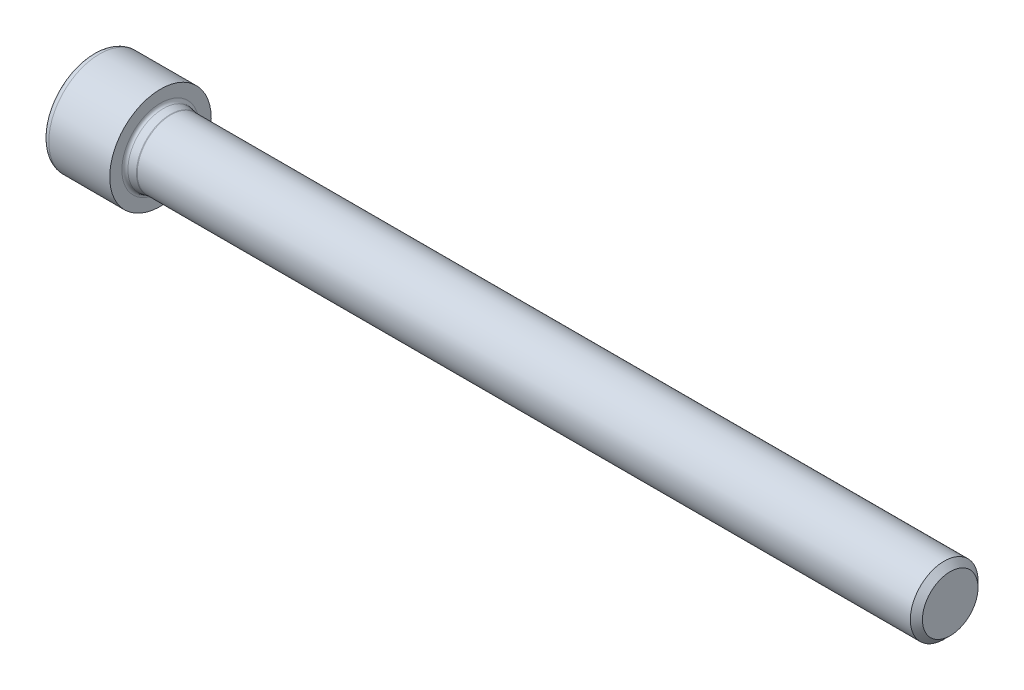
from build123d import *
from build123d.topology import SkipClean

# Parameters (mm, degrees)
SKETCH1_W           = 12
SKETCH1_H           = 9
CUT_EXTRUDE1_START  = 1.272656
CUT_EXTRUDE1_DEPTH  = 0.424218618
CUT_EXTRUDE2_DEPTH  = 5.575781382
SKETCH4_R           = 6.3565957
BOSS_EXTRUDE1_DEPTH = 1.811506156
BOSS_EXTRUDE1_TAPER = 11.136309431
SKETCH5_R           = 6
BOSS_EXTRUDE2_DEPTH = 138.188493844
CHAMFER1_SIZE       = 1.0735
FILLET1_R           = 0.6
FILLET2_R           = 1.2


with BuildPart() as part:
    # Sketch1 → Revolve1 (revolve)
    with BuildSketch(Plane.XY, mode=Mode.PRIVATE) as revolve1_sk:
        with Locations((-6, 4.5)):
            Rectangle(SKETCH1_W, SKETCH1_H)
    revolve(revolve1_sk.sketch.rotate(Axis((-12, 0, 0), (1, 0, 0)), 270), axis=Axis((-12, 0, 0), (1, 0, 0)))

    # Sketch2 → Cut-Extrude1 (cut)
    with BuildSketch(Plane.ZY.offset(10.727344145).offset(CUT_EXTRUDE1_START)):
        Polygon((-2.541695199, 4.306054284), (-2.494007969, 4.33358652), (-2.458304232, 4.354200082), (0, 5.773502692), (2.458305244, 4.354200082), (2.505992237, 4.326667984), (2.541695697, 4.306054284), (5, 2.886751346), (5, 0.048145191), (5, -0.00115583), (5, -0.048145419), (5, -2.886751346), (2.541695697, -4.306053956), (2.494008981, -4.333586191), (2.458305244, -4.354199753), (0, -5.773502692), (-2.458304232, -4.354199753), (-2.505991462, -4.326667518), (-2.541695199, -4.306053956), (-5, -2.886751346), (-5, -0.048145419), (-5, -0.00115583), (-5, 0.048145191), (-5, 2.886751346), align=None)
    extrude(amount=-CUT_EXTRUDE1_DEPTH, mode=Mode.SUBTRACT)

    # Sketch3 → Cut-Extrude2 (cut)
    with SkipClean():  # the faces are left unmerged after this step: merging them gives an invalid solid
        with BuildSketch(Plane.ZY.offset(11.575781382)):
            Polygon((0, 5.773502692), (-5, 2.886751346), (-5, -2.886751346), (0, -5.773502692), (5, -2.886751346), (5, 2.886751346), align=None)
        extrude(amount=-CUT_EXTRUDE2_DEPTH, mode=Mode.SUBTRACT)

    # Sketch4 → Boss-Extrude1 (add)
    with SkipClean():  # the faces are left unmerged after this step: merging them gives an invalid solid
        with BuildSketch(Plane(origin=(0, 0, 0), x_dir=(0, 0, -1), z_dir=(1, 0, 0))):
            Circle(SKETCH4_R)
        extrude(amount=BOSS_EXTRUDE1_DEPTH, taper=BOSS_EXTRUDE1_TAPER)

    # Sketch5 → Boss-Extrude2 (add)
    with SkipClean():  # the faces are left unmerged after this step: merging them gives an invalid solid
        with BuildSketch(Plane(origin=(1.811506156, 0, 0), x_dir=(0, 0, -1), z_dir=(1, 0, 0))):
            Circle(SKETCH5_R)
        extrude(amount=BOSS_EXTRUDE2_DEPTH)

    # Sketch6 → Cut-Revolve1 (revolve, cut)
    with SkipClean():  # the faces are left unmerged after this step: merging them gives an invalid solid
        with BuildSketch(Plane.XY, mode=Mode.PRIVATE) as cut_revolve1_sk:
            Polygon((-6, 5), (-6, 0), (-3.113248654, 0), align=None)
        revolve(cut_revolve1_sk.sketch.rotate(Axis((-6, 0, 0), (1, 0, 0)), 90), axis=Axis((-6, 0, 0), (1, 0, 0)), mode=Mode.SUBTRACT)

    # Chamfer1
    chamfer1_edges = [part.edges().sort_by_distance(p)[0] for p in [
        (140, 0, 6),
    ]]
    chamfer(chamfer1_edges, length=CHAMFER1_SIZE)

    # Fillet1
    fillet1_edges = [part.edges().sort_by_distance(p)[0] for p in [
        (0, 0, 6.3565957),
        (1.811506156, 0, 6),
    ]]
    fillet(fillet1_edges, radius=FILLET1_R)

    # Fillet2
    fillet2_edges = [part.edges().sort_by_distance(p)[0] for p in [
        (-12, 0, 9),
    ]]
    fillet(fillet2_edges, radius=FILLET2_R)


solid = part.part
